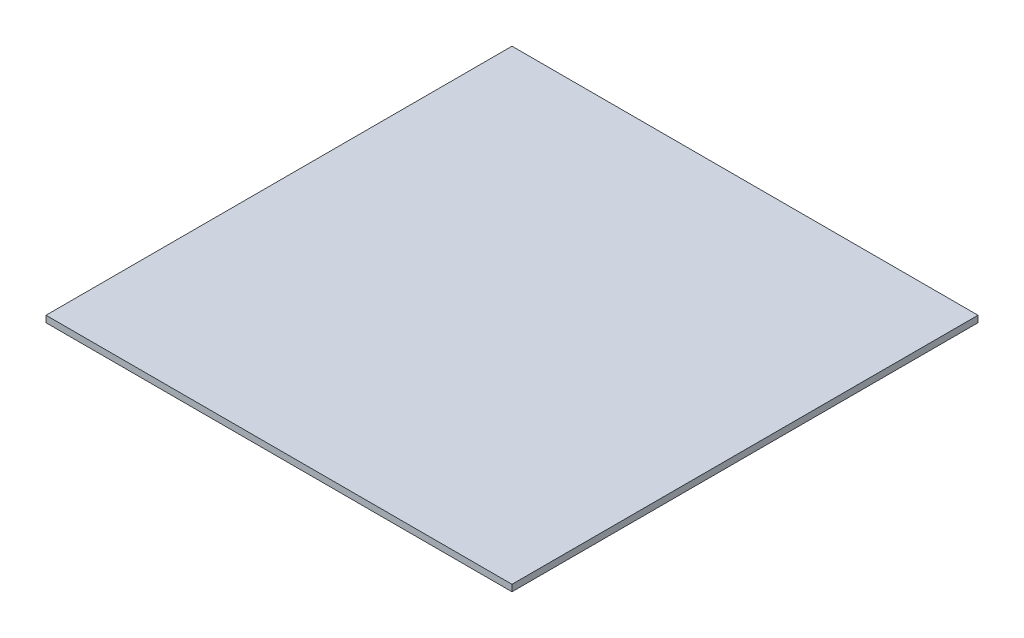
from build123d import *

# Parameters (mm, degrees)
SKETCH_1_W      = 214
SKETCH_1_H      = 214
EXTRUDE_1_DEPTH = 3


with BuildPart() as part:
    # Эскиз1 → Бобышка-Вытянуть1 (new body)
    with BuildSketch(Plane(origin=(0, 0, 0), x_dir=(1, 0, 0), z_dir=(0, 1, 0))):
        with Locations((107, 107)):
            Rectangle(SKETCH_1_W, SKETCH_1_H)
    extrude(amount=EXTRUDE_1_DEPTH)


solid = part.part
